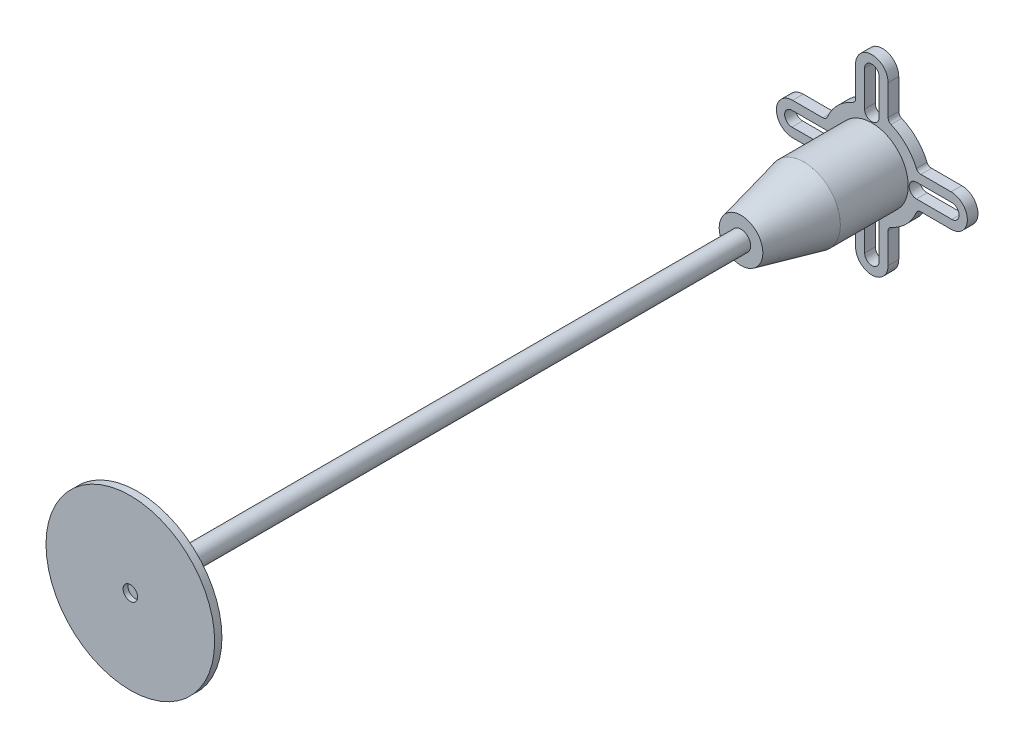
from build123d import *

# Parameters (mm, degrees)
BOSS_EXTRUDE1_DEPTH = 2.2
SKETCH2_R           = 7.5
BOSS_EXTRUDE2_DEPTH = 14
SKETCH4_R           = 2
BOSS_EXTRUDE3_DEPTH = 117
SKETCH6_R           = 17.4
BOSS_EXTRUDE4_DEPTH = 1.5
SKETCH7_R           = 1.5
CUT_EXTRUDE1_DEPTH  = 1


with BuildPart() as part:
    # Sketch1 → Boss-Extrude1 (new body)
    with BuildSketch(Plane.XY):
        with BuildLine():
            Line((-3.35, 16.35), (-3.35, 10.103341032))
            ThreePointArc((-3.35, 10.103341032), (-3.514699292, 9.553547682), (-3.954545455, 9.184855483))
            ThreePointArc((-3.954545455, 9.184855483), (-7.071067812, 7.071067812), (-9.184855483, 3.954545455))
            ThreePointArc((-9.184855483, 3.954545455), (-9.553547682, 3.514699292), (-10.103341032, 3.35))
            Line((-10.103341032, 3.35), (-16.35, 3.35))
            ThreePointArc((-16.35, 3.35), (-19.7, 0), (-16.35, -3.35))
            Line((-16.35, -3.35), (-10.103341032, -3.35))
            ThreePointArc((-10.103341032, -3.35), (-9.553547682, -3.514699292), (-9.184855483, -3.954545455))
            ThreePointArc((-9.184855483, -3.954545455), (-7.071067812, -7.071067812), (-3.954545455, -9.184855483))
            ThreePointArc((-3.954545455, -9.184855483), (-3.514699292, -9.553547682), (-3.35, -10.103341032))
            Line((-3.35, -10.103341032), (-3.35, -16.35))
            ThreePointArc((-3.35, -16.35), (0, -19.7), (3.35, -16.35))
            Line((3.35, -16.35), (3.35, -10.103341032))
            ThreePointArc((3.35, -10.103341032), (3.514699292, -9.553547682), (3.954545455, -9.184855483))
            ThreePointArc((3.954545455, -9.184855483), (7.071067812, -7.071067812), (9.184855483, -3.954545455))
            ThreePointArc((9.184855483, -3.954545455), (9.553547682, -3.514699292), (10.103341032, -3.35))
            Line((10.103341032, -3.35), (16.35, -3.35))
            ThreePointArc((16.35, -3.35), (19.7, 0), (16.35, 3.35))
            Line((16.35, 3.35), (10.103341032, 3.35))
            ThreePointArc((10.103341032, 3.35), (9.553547682, 3.514699292), (9.184855483, 3.954545455))
            ThreePointArc((9.184855483, 3.954545455), (7.071067812, 7.071067812), (3.954545455, 9.184855483))
            ThreePointArc((3.954545455, 9.184855483), (3.514699292, 9.553547682), (3.35, 10.103341032))
            Line((3.35, 10.103341032), (3.35, 16.35))
            ThreePointArc((3.35, 16.35), (0, 19.7), (-3.35, 16.35))
        make_face()
        with BuildLine():
            Line((16.5, 1.5), (9.2, 1.5))
            ThreePointArc((9.2, 1.5), (7.7, 0), (9.2, -1.5))
            Line((9.2, -1.5), (16.5, -1.5))
            ThreePointArc((16.5, -1.5), (18, 0), (16.5, 1.5))
        make_face(mode=Mode.SUBTRACT)
        with BuildLine():
            Line((-1.5, -9.2), (-1.5, -16.5))
            ThreePointArc((-1.5, -16.5), (0, -18), (1.5, -16.5))
            Line((1.5, -16.5), (1.5, -9.2))
            ThreePointArc((1.5, -9.2), (0, -7.7), (-1.5, -9.2))
        make_face(mode=Mode.SUBTRACT)
        with BuildLine():
            Line((-9.2, 1.5), (-16.5, 1.5))
            ThreePointArc((-16.5, 1.5), (-18, 0), (-16.5, -1.5))
            Line((-16.5, -1.5), (-9.2, -1.5))
            ThreePointArc((-9.2, -1.5), (-7.7, 0), (-9.2, 1.5))
        make_face(mode=Mode.SUBTRACT)
        with BuildLine():
            Line((1.5, 9.2), (1.5, 16.5))
            ThreePointArc((1.5, 16.5), (0, 18), (-1.5, 16.5))
            Line((-1.5, 16.5), (-1.5, 9.2))
            ThreePointArc((-1.5, 9.2), (0, 7.7), (1.5, 9.2))
        make_face(mode=Mode.SUBTRACT)
    extrude(amount=BOSS_EXTRUDE1_DEPTH)

    # Sketch2 → Boss-Extrude2 (add)
    with BuildSketch(Plane.XY.offset(2.2)):
        Circle(SKETCH2_R)
    extrude(amount=BOSS_EXTRUDE2_DEPTH)

    # Sketch3 → Revolve1 (revolve)
    with BuildSketch(Plane(origin=(0, 0, 0), x_dir=(1, 0, 0), z_dir=(0, 1, 0)), mode=Mode.PRIVATE) as revolve1_sk:
        Polygon((0, -16.2), (7.5, -16.2), (4.5, -29.2), (0, -29.2), align=None)
    revolve(revolve1_sk.sketch.rotate(Axis((0, 0, 16.2), (0, 0, 1)), 180), axis=Axis((0, 0, 16.2), (0, 0, 1)))

    # Sketch4 → Boss-Extrude3 (add)
    with BuildSketch(Plane.XY.offset(29.2)):
        Circle(SKETCH4_R)
    extrude(amount=BOSS_EXTRUDE3_DEPTH)

    # Sketch5 → Revolve2 (revolve)
    with BuildSketch(Plane(origin=(0, 0, 0), x_dir=(1, 0, 0), z_dir=(0, 1, 0)), mode=Mode.PRIVATE) as revolve2_sk:
        Polygon((0, -146.2), (3.4, -146.2), (7, -153.7), (0, -153.7), align=None)
    revolve(revolve2_sk.sketch.rotate(Axis((0, 0, 146.2), (0, 0, 1)), 180), axis=Axis((0, 0, 146.2), (0, 0, 1)))

    # Sketch6 → Boss-Extrude4 (add)
    with BuildSketch(Plane.XY.offset(153.7)):
        Circle(SKETCH6_R)
    extrude(amount=BOSS_EXTRUDE4_DEPTH)

    # Sketch7 → Cut-Extrude1 (cut)
    with BuildSketch(Plane.XY.offset(155.2)):
        Circle(SKETCH7_R)
    extrude(amount=-CUT_EXTRUDE1_DEPTH, mode=Mode.SUBTRACT)


solid = part.part
